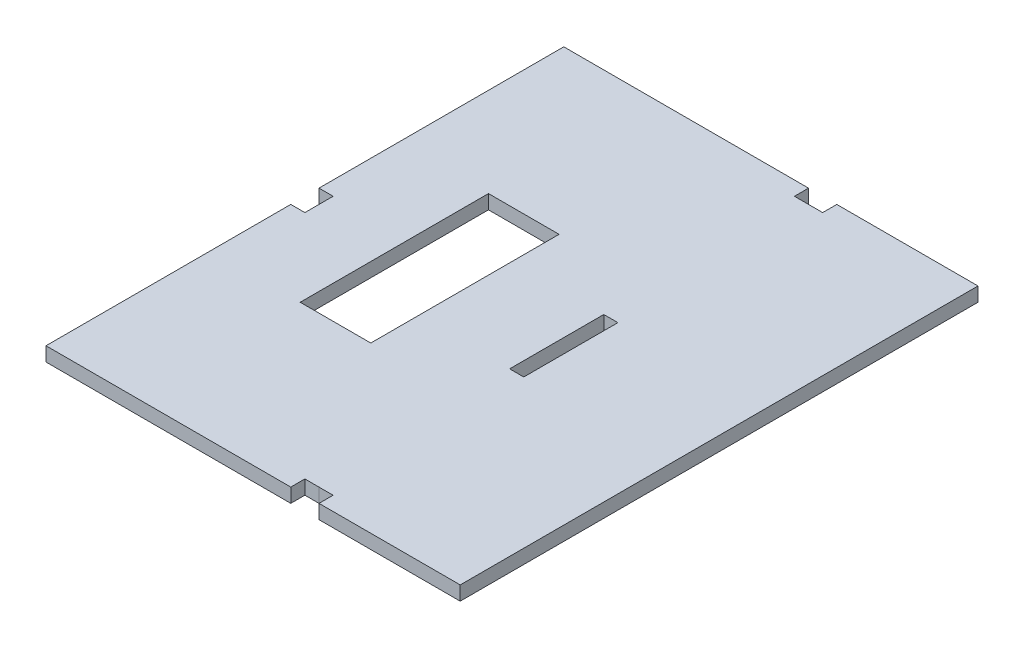
from build123d import *

# Parameters (mm, degrees)
EXTRUDE_3_DEPTH    = 3
SKETCH1_W          = 15
SKETCH1_H          = 40
SKETCH1_W_2        = 3
SKETCH1_H_2        = 20
CUT_EXTRUDE1_DEPTH = 10


with BuildPart() as part:
    # Эскиз4 → Бобышка-Вытянуть3 (new body)
    with BuildSketch(Plane(origin=(0, 0, 0), x_dir=(1, 0, 0), z_dir=(0, 1, 0))):
        Polygon((88, 0), (88, 110), (58, 110), (58, 107), (55, 107), (52, 107), (52, 110), (0, 110), (0, 58), (3, 58), (3, 55), (3, 52), (0, 52), (0, 0), (52, 0), (52.000011877, 3), (55, 2.991558491), (57.999988123, 3), (58, 0), align=None)
    extrude(amount=EXTRUDE_3_DEPTH)

    # Sketch1 → Cut-Extrude1 (cut)
    with BuildSketch(Plane(origin=(0, 3, 0), x_dir=(1, 0, 0), z_dir=(0, 1, 0))):
        with Locations((26.5, 55)):
            Rectangle(SKETCH1_W, SKETCH1_H)
        with Locations((55, 55)):
            Rectangle(SKETCH1_W_2, SKETCH1_H_2)
    extrude(amount=-CUT_EXTRUDE1_DEPTH, mode=Mode.SUBTRACT)


solid = part.part
